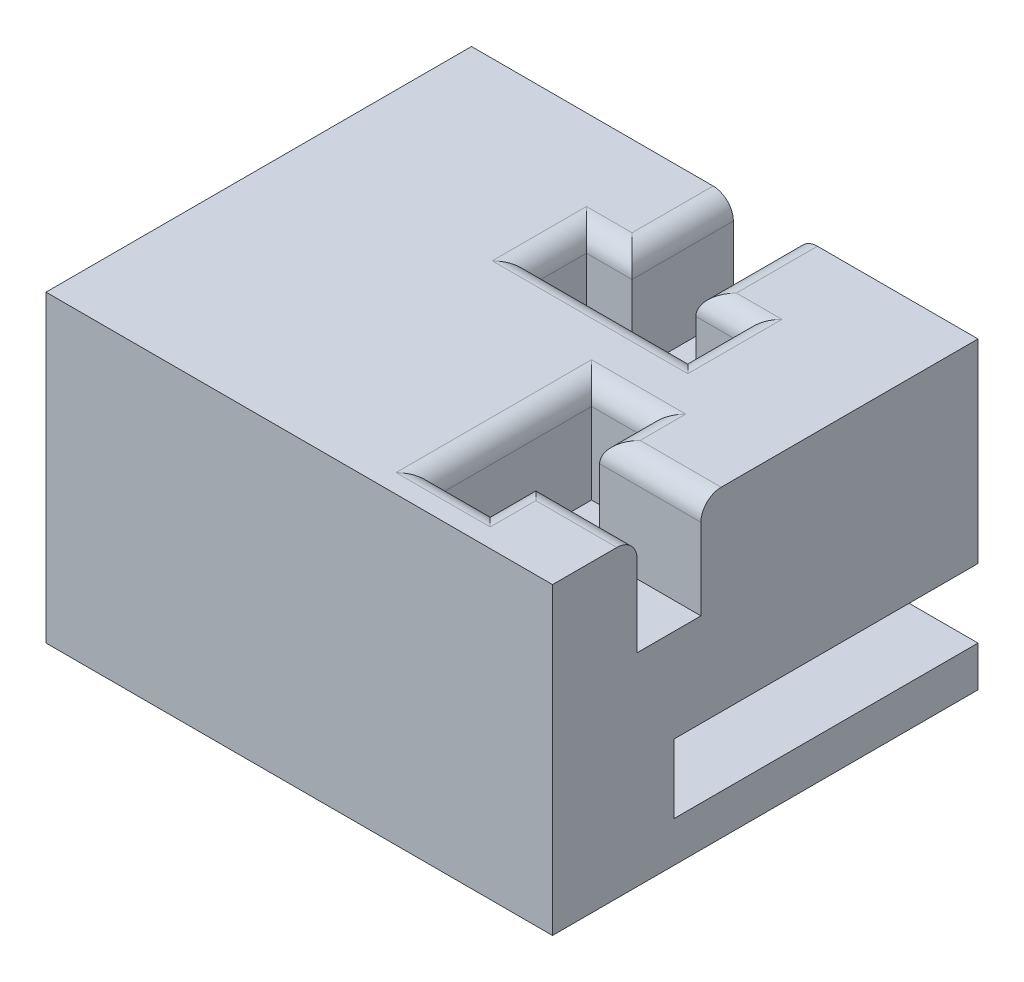
from build123d import *

# Parameters (mm, degrees)
SKETCH1_W           = 25
SKETCH1_H           = 21
BOSS_EXTRUDE1_DEPTH = 15
SKETCH2_W           = 15
SKETCH2_H           = 3.4
CUT_EXTRUDE1_DEPTH  = 22.6
CUT_EXTRUDE2_DEPTH  = 5
FILLET1_R           = 1


with BuildPart() as part:
    # Sketch1 → Boss-Extrude1 (new body)
    with BuildSketch(Plane(origin=(0, 0, 0), x_dir=(1, 0, 0), z_dir=(0, 1, 0))):
        Rectangle(SKETCH1_W, SKETCH1_H)
    extrude(amount=BOSS_EXTRUDE1_DEPTH)

    # Sketch2 → Cut-Extrude1 (cut)
    with BuildSketch(Plane.ZY.offset(12.5)):
        with Locations((-3, 3.7)):
            Rectangle(SKETCH2_W, SKETCH2_H)
    extrude(amount=-CUT_EXTRUDE1_DEPTH, mode=Mode.SUBTRACT)

    # Sketch3 → Cut-Extrude2 (cut)
    with BuildSketch(Plane(origin=(0, 15, 0), x_dir=(1, 0, 0), z_dir=(0, 1, 0))):
        Polygon((-4.85, -0.925), (-4.85, -8.575), (-7.5, -8.575), (-7.5, -6.325), (-12.5, -6.325), (-12.5, -3.175), (-7.5, -3.175), (-7.5, -0.925), align=None)
        Polygon((-3.575, 10.5), (-3.575, 5.5), (-5.825, 5.5), (-5.825, 2.85), (1.825, 2.85), (1.825, 5.5), (-0.425, 5.5), (-0.425, 10.5), align=None)
    extrude(amount=-CUT_EXTRUDE2_DEPTH, mode=Mode.SUBTRACT)

    # Fillet1
    fillet1_edges = [part.edges().sort_by_distance(p)[0] for p in [
        (-6.175, 15, 0.925),
        (-7.5, 15, 2.05),
        (-10, 15, 3.175),
        (-10, 15, 6.325),
        (-7.5, 15, 7.45),
        (-6.175, 15, 8.575),
        (-4.85, 15, 4.75),
        (-3.575, 15, -8),
        (-4.7, 15, -5.5),
        (-5.825, 15, -4.175),
        (-2, 15, -2.85),
        (1.825, 15, -4.175),
        (0.7, 15, -5.5),
        (-0.425, 15, -8),
    ]]
    fillet(fillet1_edges, radius=FILLET1_R)


with BuildPart() as body_2:
    # Mirror2: mirrored copy
    add(part.part.mirror(Plane.ZY.offset(22.5)))


solid = body_2.part
